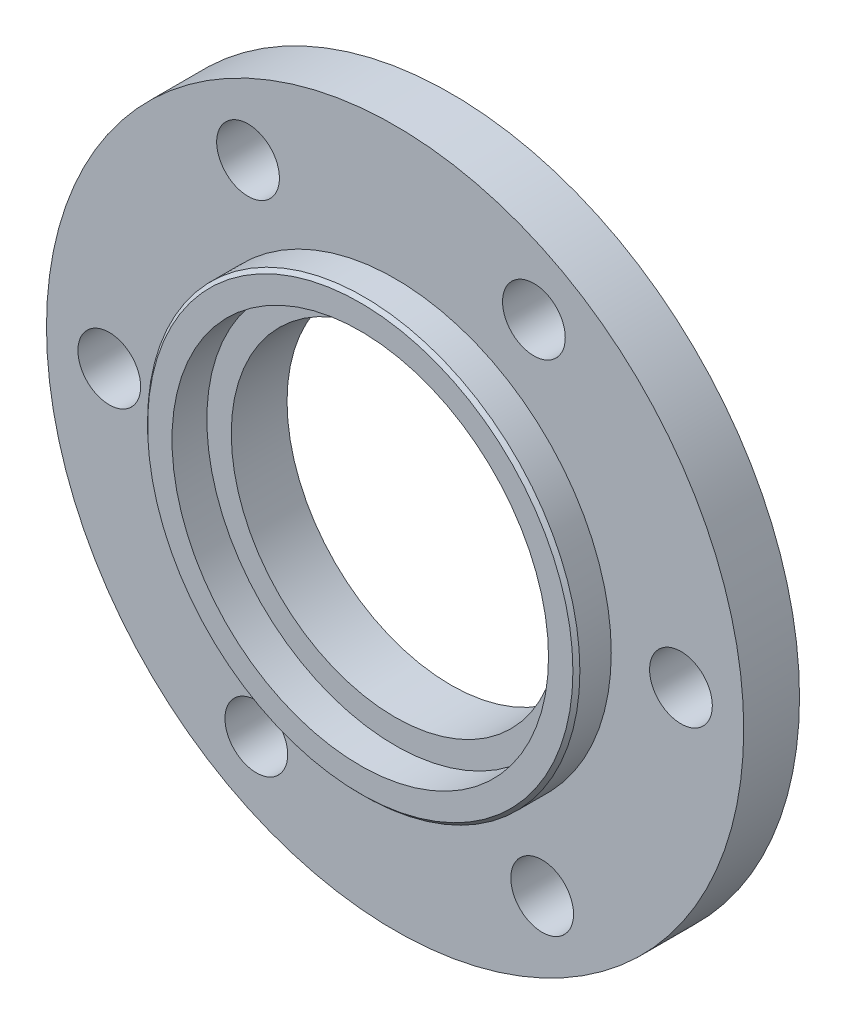
from build123d import *

# Parameters (mm, degrees)
SKETCH_1_R          = 50
EXTRUDE_1_DEPTH     = 8
SKETCH_2_R          = 31
EXTRUDE_2_DEPTH     = 5
SKETCH_3_R          = 27
CUT_EXTRUDE_2_DEPTH = 5
SKETCH_4_R          = 23.5
CUT_EXTRUDE_3_DEPTH = 72.161787499
SKETCH_5_R          = 4.5
CUT_EXTRUDE_4_DEPTH = 72.161787499
CHAMFER_1_SIZE      = 0.5


with BuildPart() as part:
    # 草图1 → 凸台-拉伸1 (new body)
    with BuildSketch(Plane.XY):
        Circle(SKETCH_1_R)
    extrude(amount=EXTRUDE_1_DEPTH)

    # 草图2 → 凸台-拉伸2 (add)
    with BuildSketch(Plane.XY.offset(8)):
        Circle(SKETCH_2_R)
    extrude(amount=EXTRUDE_2_DEPTH)

    # 草图3 → 切除-拉伸2 (cut)
    with BuildSketch(Plane.XY.offset(13)):
        Circle(SKETCH_3_R)
    extrude(amount=-CUT_EXTRUDE_2_DEPTH, mode=Mode.SUBTRACT)

    # 草图4 → 切除-拉伸3 (cut, through all)
    with BuildSketch(Plane.XY.offset(8)):
        Circle(SKETCH_4_R)
    extrude(amount=-CUT_EXTRUDE_3_DEPTH, mode=Mode.SUBTRACT)

    # 草图5 → 切除-拉伸4 (cut, through all)
    with BuildSketch(Plane.XY.offset(8)):
        with Locations((40.994281337, 0.684761001)):
            Circle(SKETCH_5_R)
        with Locations((21.090161091, -35.159708548)):
            Circle(SKETCH_5_R)
        with Locations((-19.904120246, -35.844469549)):
            Circle(SKETCH_5_R)
        with Locations((-40.994281337, -0.684761001)):
            Circle(SKETCH_5_R)
        with Locations((-21.090161091, 35.159708548)):
            Circle(SKETCH_5_R)
        with Locations((19.904120246, 35.844469549)):
            Circle(SKETCH_5_R)
    extrude(amount=-CUT_EXTRUDE_4_DEPTH, mode=Mode.SUBTRACT)

    # 倒角1
    chamfer_1_edges = [part.edges().sort_by_distance(p)[0] for p in [
        (-31, 0, 13),
    ]]
    chamfer(chamfer_1_edges, length=CHAMFER_1_SIZE)


solid = part.part
